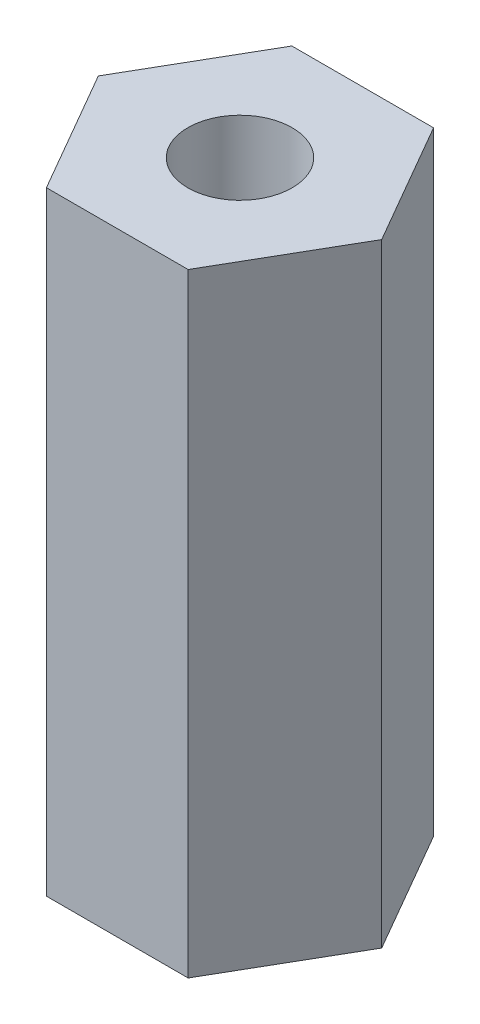
from build123d import *

# Parameters (mm, degrees)
CROQUIS1_R              = 1.7
SALIENTE_EXTRUIR1_DEPTH = 10


with BuildPart() as part:
    # Croquis1 → Saliente-Extruir1 (new, symmetric)
    with BuildSketch(Plane(origin=(0, 0, 0), x_dir=(1, 0, 0), z_dir=(0, 1, 0))):
        Polygon((-2.309401077, -4), (2.309401077, -4), (4.618802154, 0), (2.309401077, 4), (-2.309401077, 4), (-4.618802154, 0), align=None)
        with Locations(Location((0, 0, 0), (0, 0, 270))):
            Circle(CROQUIS1_R, mode=Mode.SUBTRACT)
    extrude(amount=SALIENTE_EXTRUIR1_DEPTH, both=True)


solid = part.part
